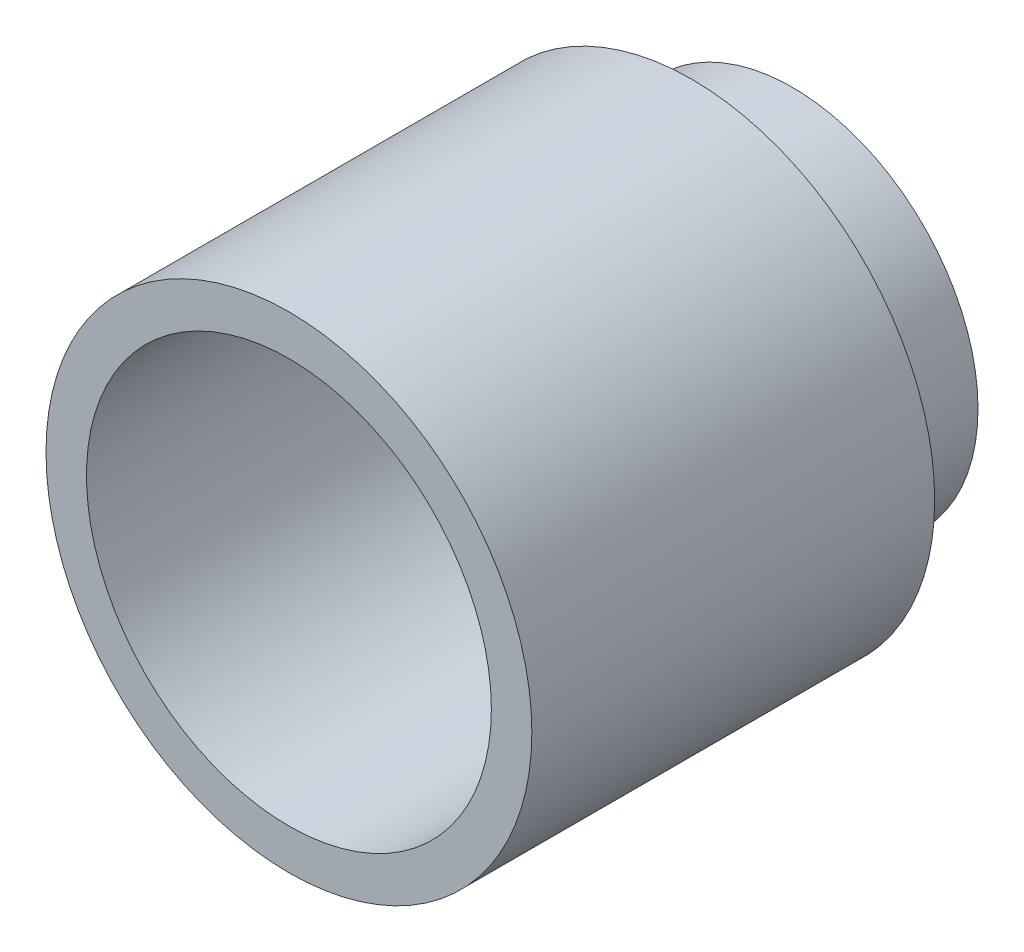
from build123d import *

# Parameters (mm, degrees)
SKETCH4_R           = 18.42
SKETCH4_R_2         = 15.35
BOSS_EXTRUDE1_DEPTH = 20
SKETCH5_R           = 20.1
SKETCH5_R_2         = 18.42
BOSS_EXTRUDE3_DEPTH = 10
SKETCH6_R           = 24.12
SKETCH6_R_2         = 20.1
BOSS_EXTRUDE4_DEPTH = 40


with BuildPart() as part:
    # Sketch4 → Boss-Extrude1 (new body)
    with BuildSketch(Plane.XY):
        Circle(SKETCH4_R)
        Circle(SKETCH4_R_2, mode=Mode.SUBTRACT)
    extrude(amount=BOSS_EXTRUDE1_DEPTH)

    # Sketch5 → Boss-Extrude3 (add)
    with BuildSketch(Plane.XY.offset(10)):
        Circle(SKETCH5_R)
        Circle(SKETCH5_R_2, mode=Mode.SUBTRACT)
    extrude(amount=BOSS_EXTRUDE3_DEPTH)

    # Sketch6 → Boss-Extrude4 (add)
    with BuildSketch(Plane.XY.offset(10)):
        Circle(SKETCH6_R)
        Circle(SKETCH6_R_2, mode=Mode.SUBTRACT)
    extrude(amount=BOSS_EXTRUDE4_DEPTH)


solid = part.part
